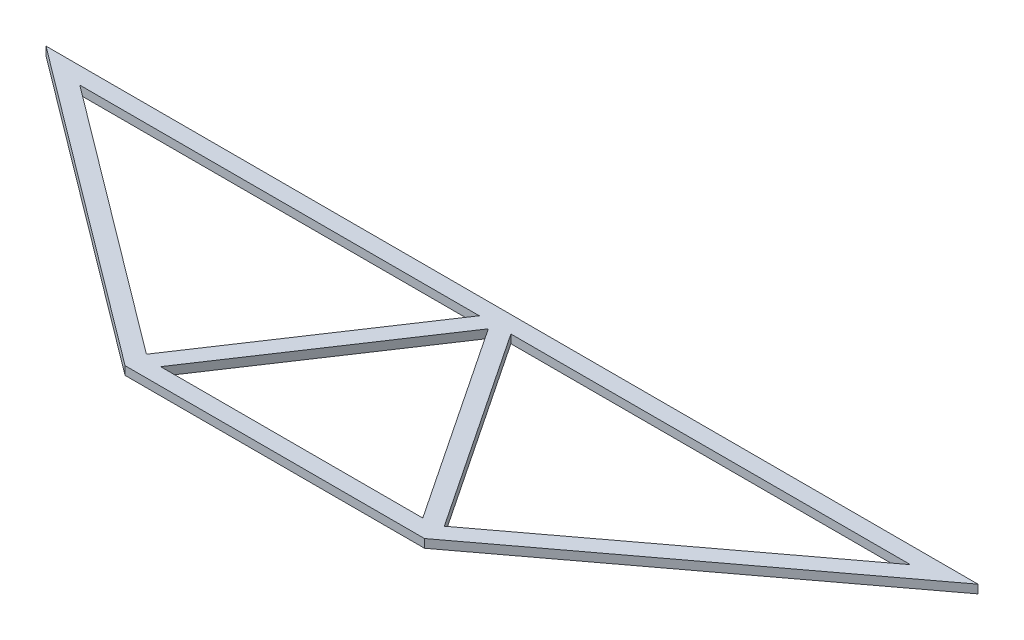
from build123d import *

# Parameters (mm, degrees)
BOSS_EXTRUDE2_DEPTH = 11.5
CUT_EXTRUDE3_REACH  = 892.817


with BuildPart() as part:
    # Sketch1 → Boss-Extrude2 (new body)
    with BuildSketch(Plane(origin=(0, 0, 0), x_dir=(1, 0, 0), z_dir=(0, 1, 0))):
        Polygon((-434.5, 311.5), (-3.833333333, -11.5), (403.833333333, -11.5), (834.5, 311.5), align=None)
    extrude(amount=BOSS_EXTRUDE2_DEPTH)

    # Sketch1<8> → Cut-Extrude3 (cut, up to next)
    with BuildSketch(Plane(origin=(0, 0, 0), x_dir=(1, 0, 0), z_dir=(0, 1, 0)), mode=Mode.PRIVATE) as cut_extrude3_sk1:
        Polygon((178.512053444, 288.5), (-365.5, 288.5), (-2.825297704, 16.493973278), align=None)
    cut_extrude3_tool1 = extrude(cut_extrude3_sk1.sketch, amount=CUT_EXTRUDE3_REACH, mode=Mode.PRIVATE) & part.part
    # Sketch1<8> → Cut-Extrude3 (cut, up to next)
    with BuildSketch(Plane(origin=(0, 0, 0), x_dir=(1, 0, 0), z_dir=(0, 1, 0)), mode=Mode.PRIVATE) as cut_extrude3_sk2:
        Polygon((200, 279.268080166), (21.487946556, 11.5), (378.512053444, 11.5), align=None)
    cut_extrude3_tool2 = extrude(cut_extrude3_sk2.sketch, amount=CUT_EXTRUDE3_REACH, mode=Mode.PRIVATE) & part.part
    # Sketch1<8> → Cut-Extrude3 (cut, up to next)
    with BuildSketch(Plane(origin=(0, 0, 0), x_dir=(1, 0, 0), z_dir=(0, 1, 0)), mode=Mode.PRIVATE) as cut_extrude3_sk3:
        Polygon((221.487946556, 288.5), (402.825297704, 16.493973278), (765.5, 288.5), align=None)
    cut_extrude3_tool3 = extrude(cut_extrude3_sk3.sketch, amount=CUT_EXTRUDE3_REACH, mode=Mode.PRIVATE) & part.part
    add(cut_extrude3_tool1.solids().sort_by_distance((-63.271081, 0, -197.831324))[0], mode=Mode.SUBTRACT)
    add(cut_extrude3_tool2.solids().sort_by_distance((200, 0, -100.756027))[0], mode=Mode.SUBTRACT)
    add(cut_extrude3_tool3.solids().sort_by_distance((463.271081, 0, -197.831324))[0], mode=Mode.SUBTRACT)


solid = part.part
